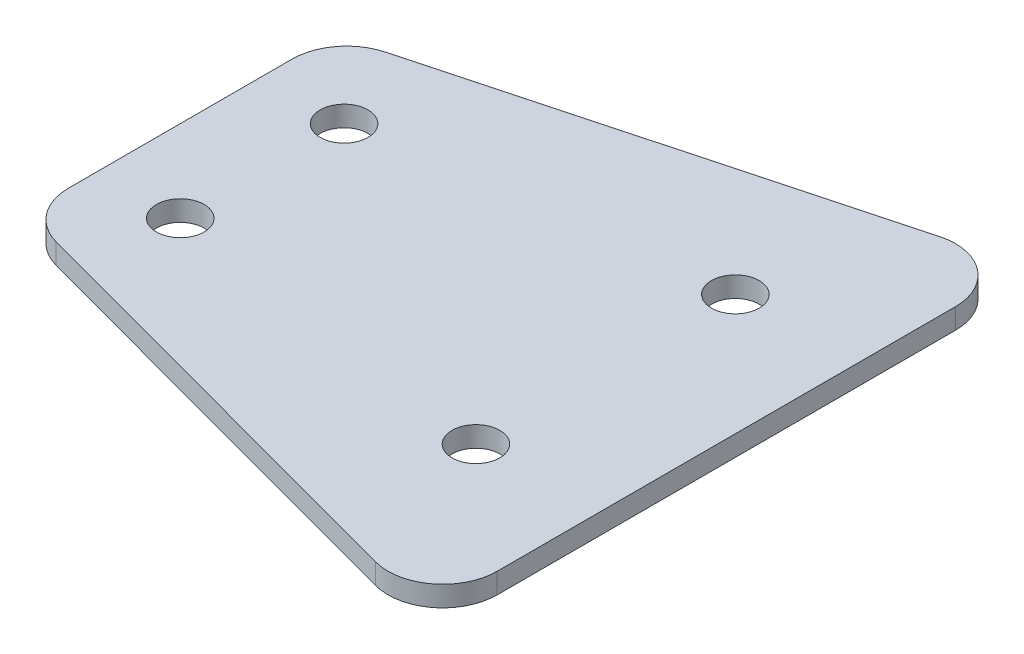
from build123d import *

# Parameters (mm, degrees)
BOSS_EXTRUDE2_DEPTH = 1.5
SKETCH3_R           = 3.5
CUT_EXTRUDE1_DEPTH  = 58.764549458


with BuildPart() as part:
    # Sketch1 → Boss-Extrude2 (new, symmetric)
    with BuildSketch(Plane(origin=(0, 0, 0), x_dir=(1, 0, 0), z_dir=(0, 1, 0))):
        with BuildLine():
            Line((-40, 0), (-40, -16.366130131))
            ThreePointArc((-40, -16.366130131), (-38.348645293, -21.23385064), (-34.076324263, -24.091987854))
            Line((-34.076324263, -24.091987854), (29.923675737, -41.291987854))
            ThreePointArc((29.923675737, -41.291987854), (36.867720508, -39.914775424), (40, -33.566130131))
            Line((40, -33.566130131), (40, 0))
            Line((40, 0), (-40, 0))
        make_face()
        with BuildLine():
            Line((-40, 16.366130131), (-40, 0))
            Line((-40, 0), (40, 0))
            Line((40, 0), (40, 33.566130131))
            ThreePointArc((40, 33.566130131), (36.867720508, 39.914775424), (29.923675737, 41.291987854))
            Line((29.923675737, 41.291987854), (-34.076324263, 24.091987854))
            ThreePointArc((-34.076324263, 24.091987854), (-38.348645293, 21.23385064), (-40, 16.366130131))
        make_face()
    extrude(amount=BOSS_EXTRUDE2_DEPTH, both=True)

    # Sketch3 → Cut-Extrude1 (cut, through all)
    with BuildSketch(Plane(origin=(0, 1.5, 0), x_dir=(1, 0, 0), z_dir=(0, 1, 0))):
        with Locations(Location((22.315405196, 19, 0), (0, 0, 270))):
            Circle(SKETCH3_R)
        with Locations(Location((-28, 12, 0), (0, 0, 270))):
            Circle(SKETCH3_R)
        with Locations(Location((22.315405196, -19, 0), (0, 0, 90))):
            Circle(SKETCH3_R)
        with Locations(Location((-28, -12, 0), (0, 0, 90))):
            Circle(SKETCH3_R)
    extrude(amount=-CUT_EXTRUDE1_DEPTH, mode=Mode.SUBTRACT)


solid = part.part
